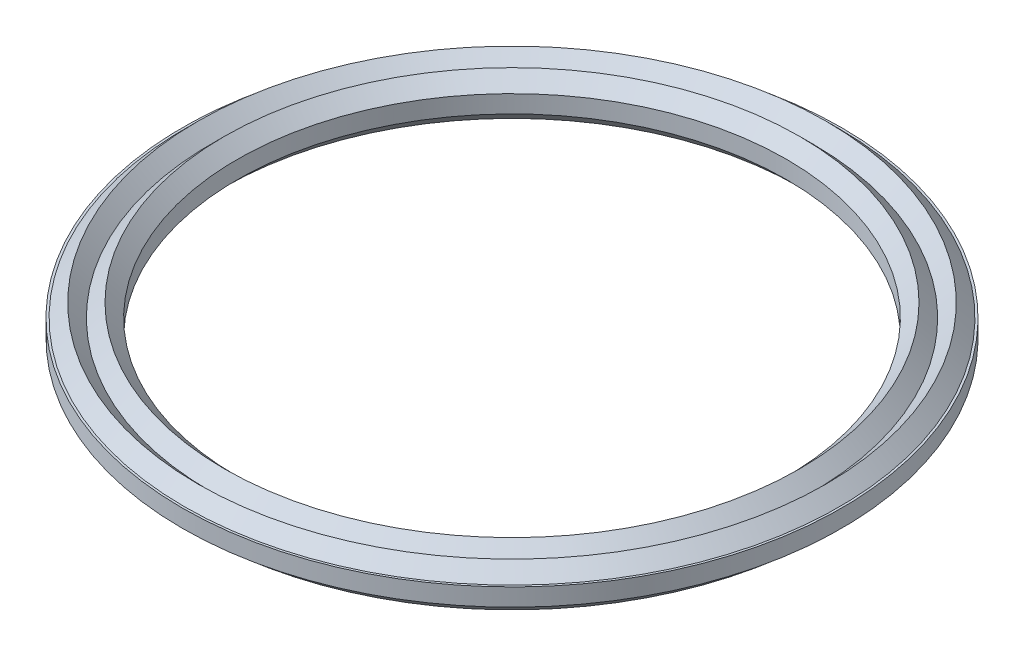
from build123d import *


with BuildPart() as part:
    # Эскиз1 → Повернуть1 (revolve)
    with BuildSketch(Plane.XY, mode=Mode.PRIVATE) as revolve_1_sk:
        Polygon((12.5, 0.4), (12.5, -0.4), (13.1, -1), (13.7, -0.4), (14.3, -1), (14.9, -0.4), (15, -0.4), (15, 0.4), (14.9, 0.4), (14.3, 1), (13.7, 0.4), (13.1, 1), align=None)
    revolve(revolve_1_sk.sketch.rotate(Axis((0, 0, 0), (0, 1, 0)), 90), axis=Axis((0, 0, 0), (0, 1, 0)))


solid = part.part
